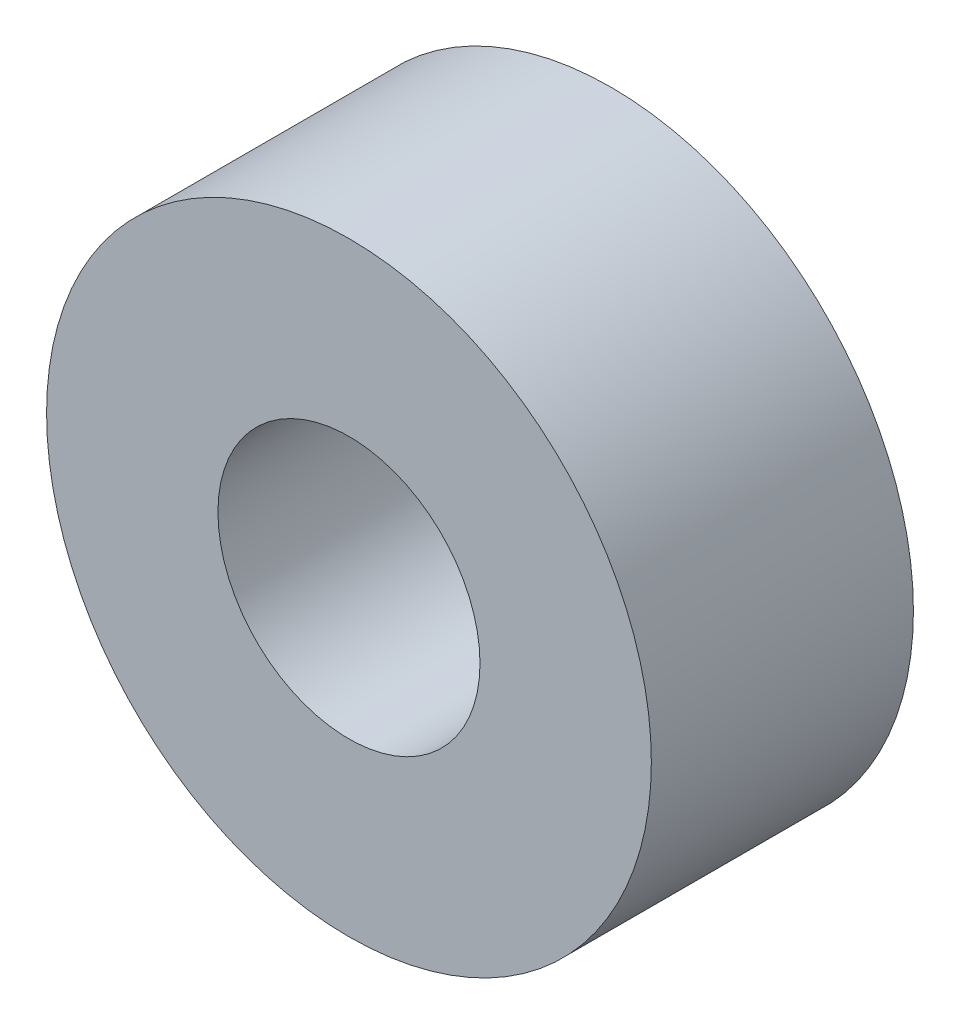
from build123d import *

# Parameters (mm, degrees)
SKETCH1_R           = 7.5
BOSS_EXTRUDE1_DEPTH = 6.5
SKETCH3_R           = 3.25
CUT_EXTRUDE1_DEPTH  = 10


with BuildPart() as part:
    # Sketch1 → Boss-Extrude1 (new body)
    with BuildSketch(Plane.XY):
        Circle(SKETCH1_R)
    extrude(amount=BOSS_EXTRUDE1_DEPTH)

    # Sketch3 → Cut-Extrude1 (cut)
    with BuildSketch(Plane(origin=(0, 0, 0), x_dir=(-1, 0, 0), z_dir=(0, 0, -1))):
        Circle(SKETCH3_R)
    extrude(amount=-CUT_EXTRUDE1_DEPTH, mode=Mode.SUBTRACT)


solid = part.part
